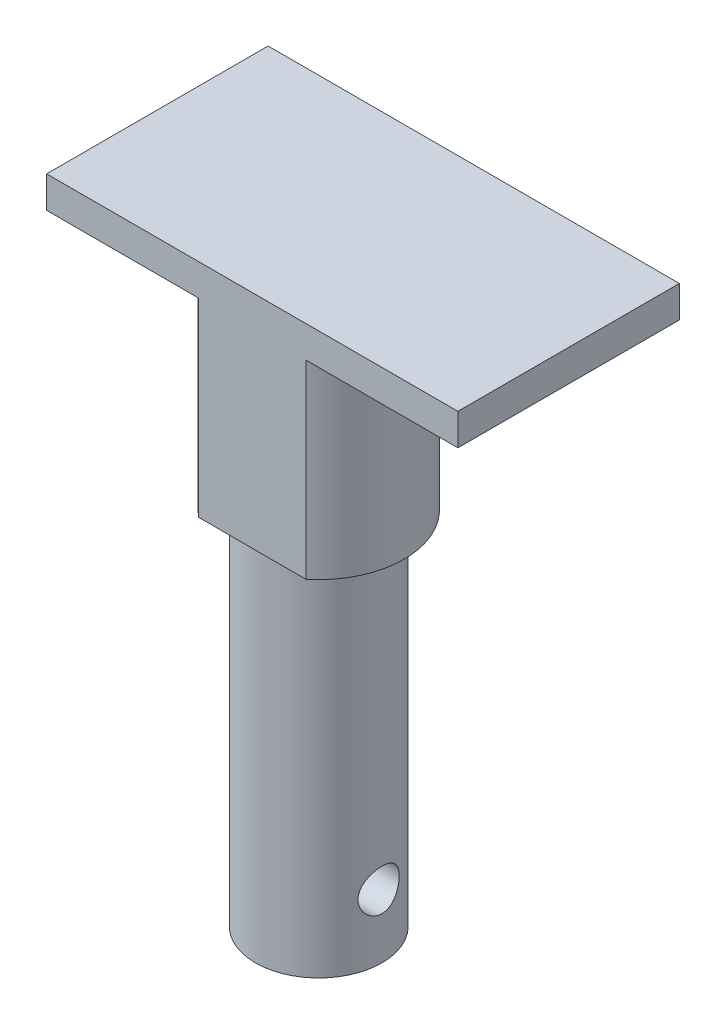
from build123d import *

# Parameters (mm, degrees)
SKETCH_1_R               = 10
EXTRUDE_1_DEPTH          = 57
SKETCH_2_R               = 13.5
EXTRUDE_2_DEPTH          = 30
CUT_EXTRUDE_1_DEPTH      = 90.070197036
CUT_EXTRUDE_1_DEPTH_BACK = 90.070197036
SKETCH_7_R               = 3.25
SKETCH_8_W               = 27
SKETCH_8_H               = 6
CUT_EXTRUDE_2_DEPTH      = 90.070197133
SKETCH_9_W               = 65
SKETCH_9_H               = 35
EXTRUDE_3_DEPTH          = 5


with BuildPart() as part:
    # 스케치1 → 보스-돌출1 (new body)
    with BuildSketch(Plane(origin=(0, 0, 0), x_dir=(1, 0, 0), z_dir=(0, 1, 0))):
        with Locations(Location((0, 0, 0), (0, 0, 90))):
            Circle(SKETCH_1_R)
    extrude(amount=EXTRUDE_1_DEPTH)

    # 스케치2 → 보스-돌출2 (add)
    with BuildSketch(Plane(origin=(0, 57, 0), x_dir=(1, 0, 0), z_dir=(0, 1, 0))):
        with Locations(Location((0, 0, 0), (0, 0, 270))):
            Circle(SKETCH_2_R)
    extrude(amount=EXTRUDE_2_DEPTH)

    # 스케치7 → 컷-돌출1 (cut, two sides: drawn at the far end of the back side and taken through both)
    with BuildSketch(Plane(origin=(0, 0, 0), x_dir=(0, 0, -1), z_dir=(1, 0, 0)).offset(-CUT_EXTRUDE_1_DEPTH_BACK)):
        with Locations((0, 10)):
            Circle(SKETCH_7_R)
    extrude(amount=CUT_EXTRUDE_1_DEPTH + CUT_EXTRUDE_1_DEPTH_BACK, mode=Mode.SUBTRACT)

    # 스케치8 → 컷-돌출2 (cut, through all)
    with BuildSketch(Plane(origin=(0, 87, 0), x_dir=(1, 0, 0), z_dir=(0, 1, 0))):
        with Locations((0, -13.5)):
            Rectangle(SKETCH_8_W, SKETCH_8_H)
    extrude(amount=-CUT_EXTRUDE_2_DEPTH, mode=Mode.SUBTRACT)

    # 스케치9 → 보스-돌출3 (add)
    with BuildSketch(Plane(origin=(0, 87, 0), x_dir=(1, 0, 0), z_dir=(0, 1, 0))):
        with Locations((0, 7)):
            Rectangle(SKETCH_9_W, SKETCH_9_H)
    extrude(amount=EXTRUDE_3_DEPTH)


solid = part.part
